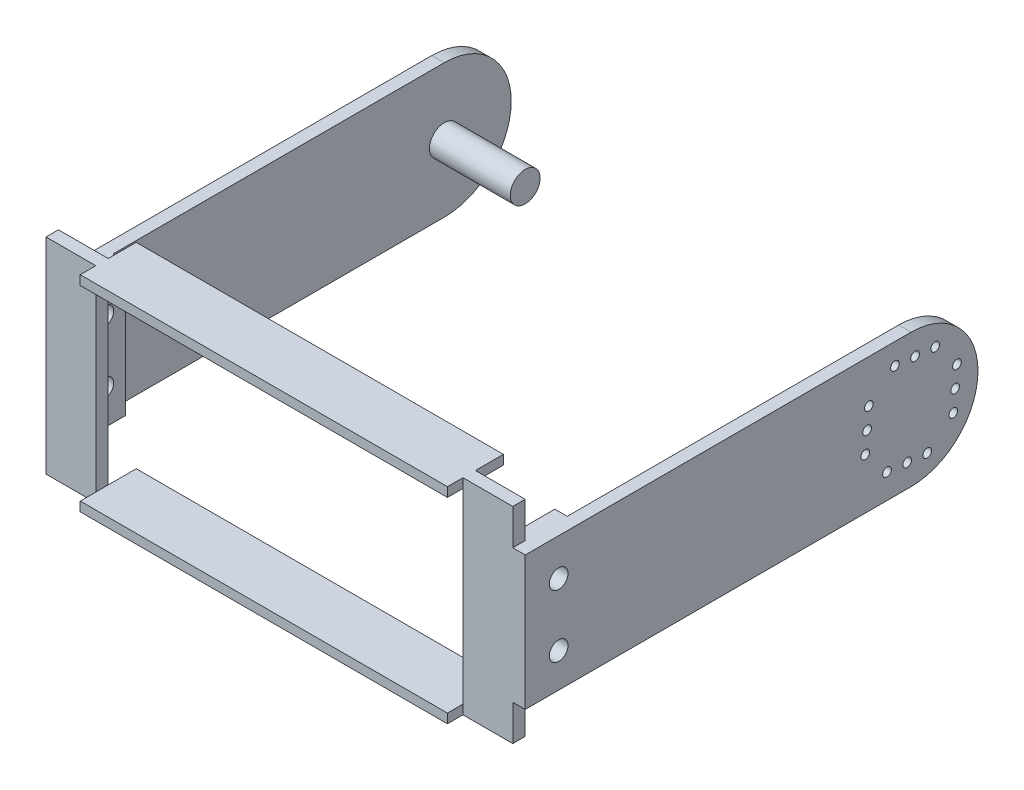
from build123d import *

# Parameters (mm, degrees)
SKETCH_2_R               = 10.75
SKETCH_2_R_2             = 0.5
EXTRUDE_1_DEPTH          = 2
EXTRUDE_3_DEPTH          = 2
SKETCH_4_W               = 2
SKETCH_4_H               = 33
EXTRUDE_4_DEPTH          = 75
SKETCH_8_R               = 0.7
CUT_EXTRUDE_1_DEPTH      = 7
SKETCH_9_W               = 2
SKETCH_9_H               = 21.5
EXTRUDE_7_DEPTH          = 60
EXTRUDE_2_DEPTH          = 2
SKETCH_11_R              = 2.4
EXTRUDE_8_DEPTH          = 15
SKETCH_12_W              = 59
SKETCH_12_H              = 30
CUT_EXTRUDE_2_DEPTH      = 15
SKETCH_13_W              = 59
SKETCH_13_H              = 1.5
EXTRUDE_9_DEPTH          = 4.5
SKETCH_15_W              = 6.749564512
SKETCH_15_H              = 21.5
EXTRUDE_10_DEPTH         = 2
SKETCH_16_W              = 6.749564512
SKETCH_16_H              = 21.5
EXTRUDE_11_DEPTH         = 2
CUT_EXTRUDE_3_DEPTH      = 173.33717765
CUT_EXTRUDE_3_DEPTH_BACK = 173.33717765
SKETCH_17_R              = 1.5


with BuildPart() as part:
    # 스케치2 → 보스-돌출1 (new body)
    with BuildSketch(Plane(origin=(62.38287134, 0, 0), x_dir=(0, 0, -1), z_dir=(1, 0, 0))):
        with Locations((-65.677419436, 69.66810471)):
            Circle(SKETCH_2_R)
        with Locations((-61.803243354, 76.447725619)):
            Circle(SKETCH_2_R_2, mode=Mode.SUBTRACT)
        with Locations((-65.040124528, 76.73944512)):
            Circle(SKETCH_2_R_2, mode=Mode.SUBTRACT)
        with Locations((-68.277005701, 77.03116462)):
            Circle(SKETCH_2_R_2, mode=Mode.SUBTRACT)
        with Locations((-72.457040346, 73.542280792)):
            Circle(SKETCH_2_R_2, mode=Mode.SUBTRACT)
        with Locations((-72.748759847, 70.305399618)):
            Circle(SKETCH_2_R_2, mode=Mode.SUBTRACT)
        with Locations((-73.040479347, 67.068518444)):
            Circle(SKETCH_2_R_2, mode=Mode.SUBTRACT)
        with Locations((-69.551595519, 62.8884838)):
            Circle(SKETCH_2_R_2, mode=Mode.SUBTRACT)
        with Locations((-66.314714345, 62.596764299)):
            Circle(SKETCH_2_R_2, mode=Mode.SUBTRACT)
        with Locations((-63.077833171, 62.305044799)):
            Circle(SKETCH_2_R_2, mode=Mode.SUBTRACT)
        with Locations((-58.897798526, 65.793928627)):
            Circle(SKETCH_2_R_2, mode=Mode.SUBTRACT)
        with Locations((-58.606079026, 69.030809801)):
            Circle(SKETCH_2_R_2, mode=Mode.SUBTRACT)
        with Locations((-58.314359525, 72.267690975)):
            Circle(SKETCH_2_R_2, mode=Mode.SUBTRACT)
    extrude(amount=EXTRUDE_1_DEPTH)

    # 스케치3 → 보스-돌출3 (add)
    with BuildSketch(Plane.ZY.offset(-62.38287134)):
        with BuildLine():
            Line((65.677419436, 80.41810471), (127.677419436, 80.41810471))
            Line((127.677419436, 80.41810471), (127.677419436, 58.91810471))
            Line((127.677419436, 58.91810471), (65.677419436, 58.91810471))
            ThreePointArc((65.677419436, 58.91810471), (76.427419436, 69.66810471), (65.677419436, 80.41810471))
        make_face()
    extrude(amount=-EXTRUDE_3_DEPTH)

    # 스케치4 → 보스-돌출4 (add)
    with BuildSketch(Plane.ZY.offset(-62.38287134)):
        with Locations((126.677419436, 69.66810471)):
            Rectangle(SKETCH_4_W, SKETCH_4_H)
    extrude(amount=EXTRUDE_4_DEPTH)

    # 스케치8 → 컷-돌출1 (cut)
    with BuildSketch(Plane(origin=(64.38287134, 0, 0), x_dir=(0, 0, -1), z_dir=(1, 0, 0))):
        with Locations((-68.277005701, 77.03116462)):
            Circle(SKETCH_8_R)
        with Locations((-65.040124528, 76.73944512)):
            Circle(SKETCH_8_R)
        with Locations((-61.803243354, 76.447725619)):
            Circle(SKETCH_8_R)
        with Locations((-58.314359525, 72.267690975)):
            Circle(SKETCH_8_R)
        with Locations((-58.606079026, 69.030809801)):
            Circle(SKETCH_8_R)
        with Locations((-58.897798526, 65.793928627)):
            Circle(SKETCH_8_R)
        with Locations((-63.077833171, 62.305044799)):
            Circle(SKETCH_8_R)
        with Locations((-66.314714345, 62.596764299)):
            Circle(SKETCH_8_R)
        with Locations((-69.551595519, 62.8884838)):
            Circle(SKETCH_8_R)
        with Locations((-73.040479347, 67.068518444)):
            Circle(SKETCH_8_R)
        with Locations((-72.748759847, 70.305399618)):
            Circle(SKETCH_8_R)
        with Locations((-72.457040346, 73.542280792)):
            Circle(SKETCH_8_R)
    extrude(amount=-CUT_EXTRUDE_1_DEPTH, mode=Mode.SUBTRACT)

    # 스케치9 → 보스-돌출7 (add)
    with BuildSketch(Plane(origin=(0, 0, 125.677419436), x_dir=(-1, 0, 0), z_dir=(0, 0, -1))):
        with Locations((11.61712866, 69.66810471)):
            Rectangle(SKETCH_9_W, SKETCH_9_H)
    extrude(amount=EXTRUDE_7_DEPTH)

    # 스케치10 → 돌출-얇게2 (add)
    with BuildSketch(Plane.ZY.offset(12.61712866)):
        with BuildLine():
            ThreePointArc((65.677419436, 80.41810471), (54.927419436, 69.66810471), (65.677419436, 58.91810471))
            Line((65.677419436, 58.91810471), (65.677419436, 68.91810471))
            ThreePointArc((65.677419436, 68.91810471), (64.927419436, 69.66810471), (65.677419436, 70.41810471))
            Line((65.677419436, 70.41810471), (65.677419436, 80.41810471))
        make_face()
    extrude(amount=-EXTRUDE_2_DEPTH)

    # 스케치11 → 보스-돌출8 (add)
    with BuildSketch(Plane.ZY.offset(12.61712866)):
        with Locations((65.677419436, 69.66810471)):
            Circle(SKETCH_11_R)
    extrude(amount=-EXTRUDE_8_DEPTH)

    # 스케치12 → 컷-돌출2 (cut)
    with BuildSketch(Plane.XY.offset(127.677419436)):
        with Locations((24.88287134, 69.66810471)):
            Rectangle(SKETCH_12_W, SKETCH_12_H)
    extrude(amount=-CUT_EXTRUDE_2_DEPTH, mode=Mode.SUBTRACT)

    # 스케치13 → 보스-돌출9 (add, symmetric)
    with BuildSketch(Plane(origin=(0, 0, 125.677419436), x_dir=(-1, 0, 0), z_dir=(0, 0, -1))):
        with Locations((-24.88287134, 53.91810471)):
            Rectangle(SKETCH_13_W, SKETCH_13_H)
        with Locations((-24.88287134, 85.41810471)):
            Rectangle(SKETCH_13_W, SKETCH_13_H)
    extrude(amount=EXTRUDE_9_DEPTH, both=True)

    # 스케치15 → 보스-돌출10 (add)
    with BuildSketch(Plane.ZY.offset(-62.38287134)):
        with Locations((122.30263718, 69.66810471)):
            Rectangle(SKETCH_15_W, SKETCH_15_H)
    extrude(amount=EXTRUDE_10_DEPTH)

    # 스케치16 → 보스-돌출11 (add)
    with BuildSketch(Plane(origin=(-10.61712866, 0, 0), x_dir=(0, 0, -1), z_dir=(1, 0, 0))):
        with Locations((-122.30263718, 69.66810471)):
            Rectangle(SKETCH_16_W, SKETCH_16_H)
    extrude(amount=EXTRUDE_11_DEPTH)

    # 스케치17 → 컷-돌출3 (cut, two sides: drawn at the far end of the back side and taken through both)
    with BuildSketch(Plane.ZY.offset(-60.38287134).offset(-CUT_EXTRUDE_3_DEPTH_BACK)):
        with Locations((122.30263718, 74.43740033)):
            Circle(SKETCH_17_R)
        with Locations((122.30263718, 64.421879527)):
            Circle(SKETCH_17_R)
    extrude(amount=CUT_EXTRUDE_3_DEPTH + CUT_EXTRUDE_3_DEPTH_BACK, mode=Mode.SUBTRACT)


solid = part.part
